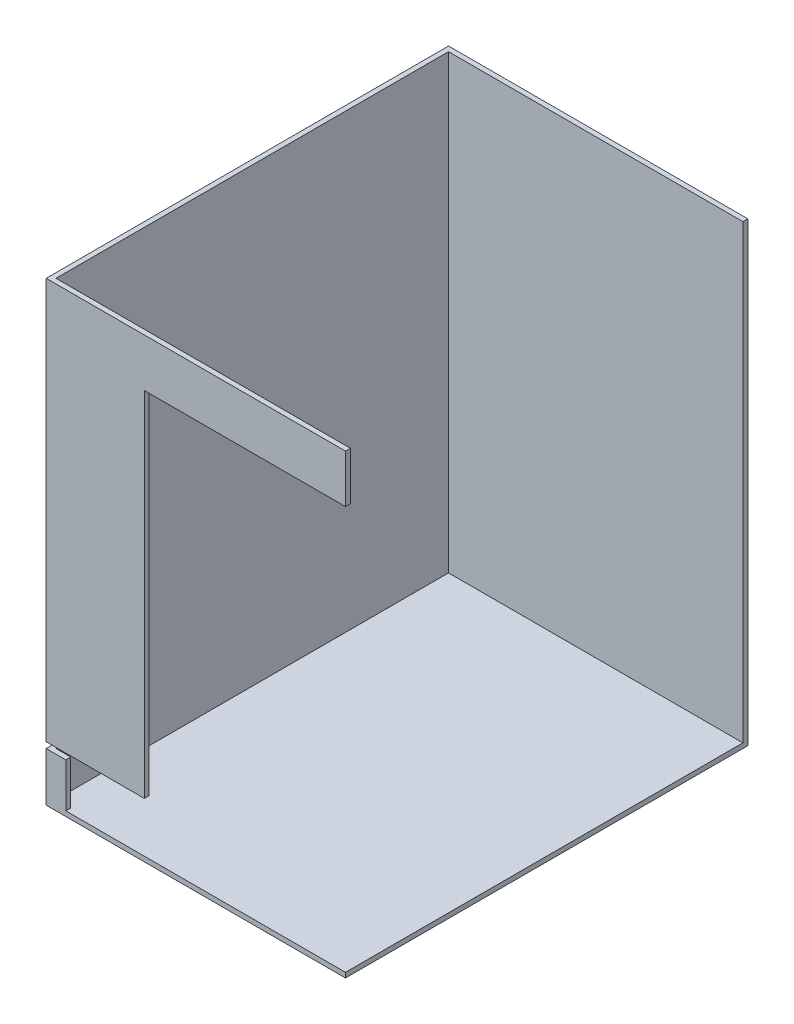
from build123d import *

# Parameters (mm, degrees)
SKETCH_1_W          = 150
SKETCH_1_H          = 200
EXTRUDE_1_DEPTH     = 230
SHELL_1_T           = 2.5
CUT_EXTRUDE_1_DEPTH = 3
SKETCH_6_W          = 142.5
SKETCH_6_H          = 22.5
CUT_EXTRUDE_2_DEPTH = 30


with BuildPart() as part:
    # 草图1 → 凸台-拉伸1 (new body)
    with BuildSketch(Plane(origin=(0, 0, 0), x_dir=(1, 0, 0), z_dir=(0, 1, 0))):
        with Locations((75, -100)):
            Rectangle(SKETCH_1_W, SKETCH_1_H)
    extrude(amount=EXTRUDE_1_DEPTH)

    # 抽壳1
    shell_1_openings = [part.faces().sort_by_distance(p)[0] for p in [
        (150, 115, 100),
        (75, 230, 100),
    ]]
    offset(amount=SHELL_1_T, openings=shell_1_openings, kind=Kind.INTERSECTION)

    # 草图2 → 切除-拉伸1 (cut)
    with BuildSketch(Plane.XY.offset(202.5)):
        Polygon((-2.5, 25.5), (47.5, 25.5), (47.5, 205.5), (150, 205.5), (150, 30.5), (150, 27.5), (150, 22.5), (-2.5, 22.5), align=None)
    extrude(amount=-CUT_EXTRUDE_1_DEPTH, mode=Mode.SUBTRACT)

    # 草图6 → 切除-拉伸2 (cut)
    with BuildSketch(Plane.XY.offset(202.5)):
        with Locations((78.75, 11.25)):
            Rectangle(SKETCH_6_W, SKETCH_6_H)
    extrude(amount=-CUT_EXTRUDE_2_DEPTH, mode=Mode.SUBTRACT)


solid = part.part
